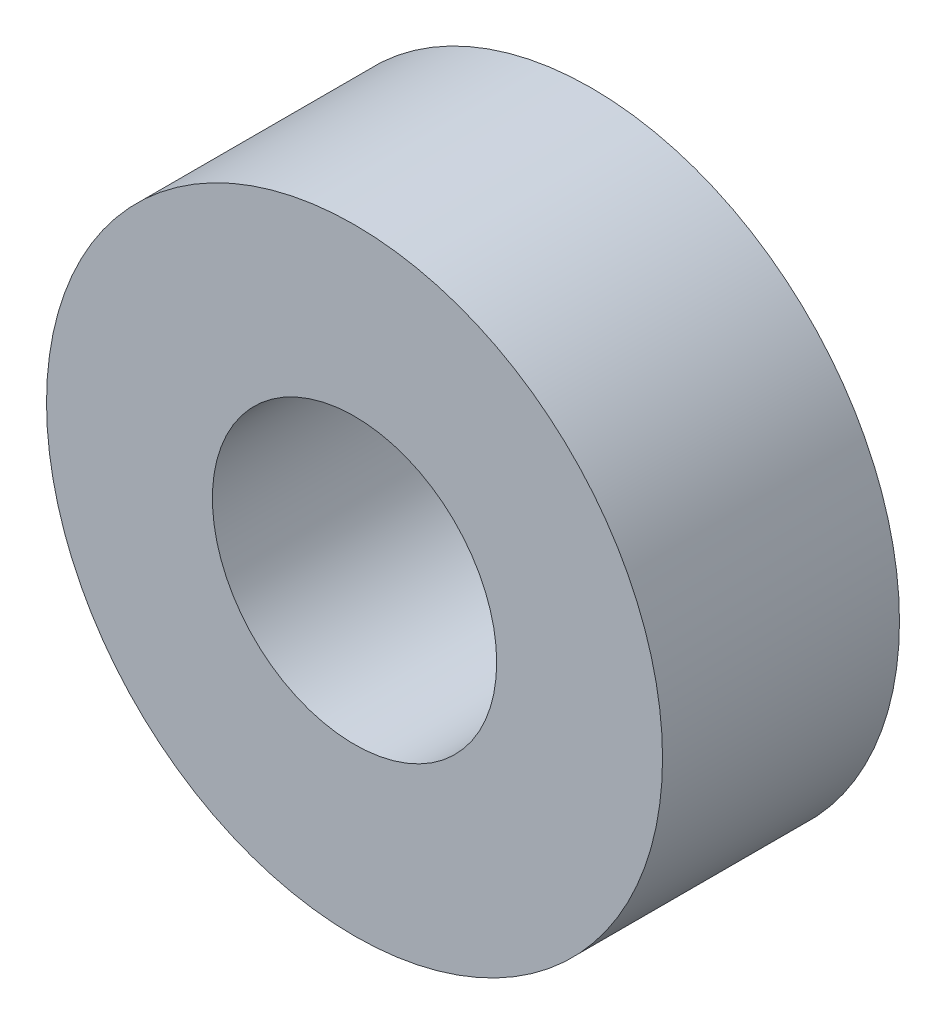
from build123d import *

# Parameters (mm, degrees)
SKETCH1_R           = 6.5
BOSS_EXTRUDE1_DEPTH = 5
SKETCH3_R           = 3
CUT_EXTRUDE1_DEPTH  = 11.464224768


with BuildPart() as part:
    # Sketch1 → Boss-Extrude1 (new body)
    with BuildSketch(Plane.XY):
        Circle(SKETCH1_R)
    extrude(amount=BOSS_EXTRUDE1_DEPTH)

    # Sketch3 → Cut-Extrude1 (cut, through all)
    with BuildSketch(Plane.XY.offset(5)):
        Circle(SKETCH3_R)
    extrude(amount=-CUT_EXTRUDE1_DEPTH, mode=Mode.SUBTRACT)


solid = part.part
